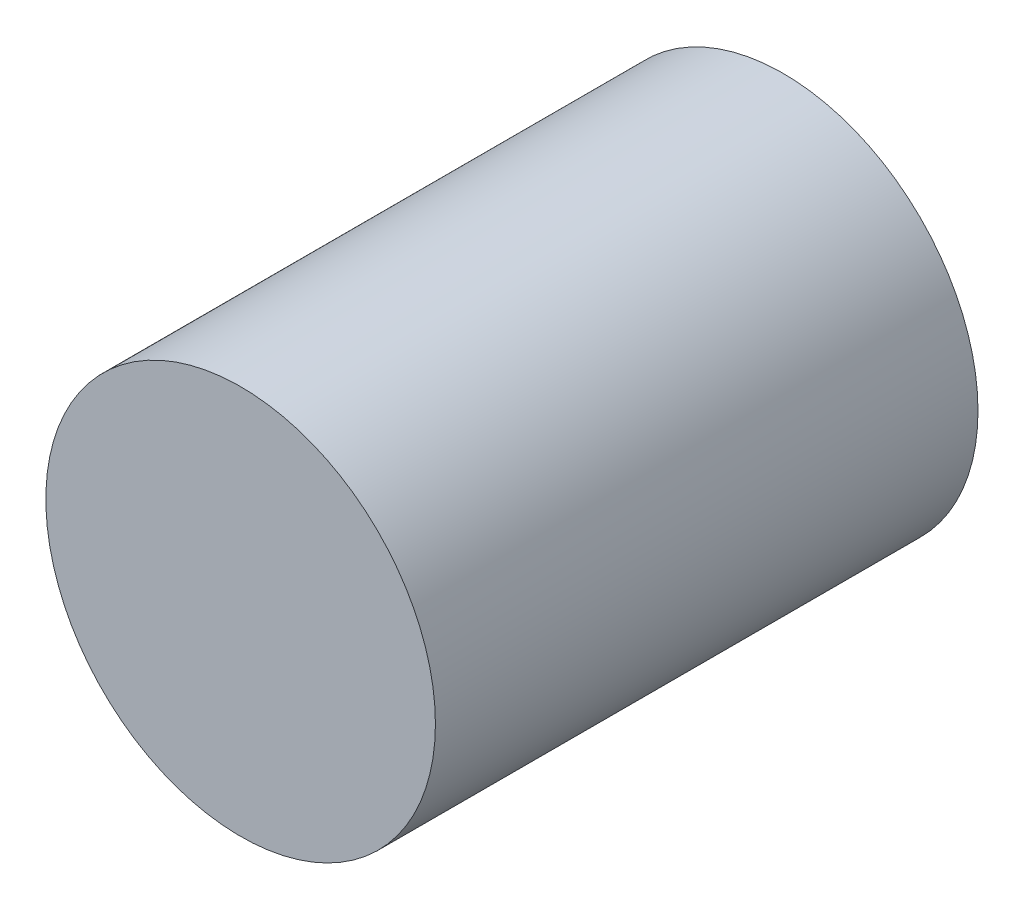
from build123d import *

# Parameters (mm, degrees)
SKETCH2_R           = 7.18
BOSS_EXTRUDE1_DEPTH = 20


with BuildPart() as part:
    # Sketch2 → Boss-Extrude1 (new body)
    with BuildSketch(Plane.XY):
        Circle(SKETCH2_R)
    extrude(amount=BOSS_EXTRUDE1_DEPTH)


solid = part.part
